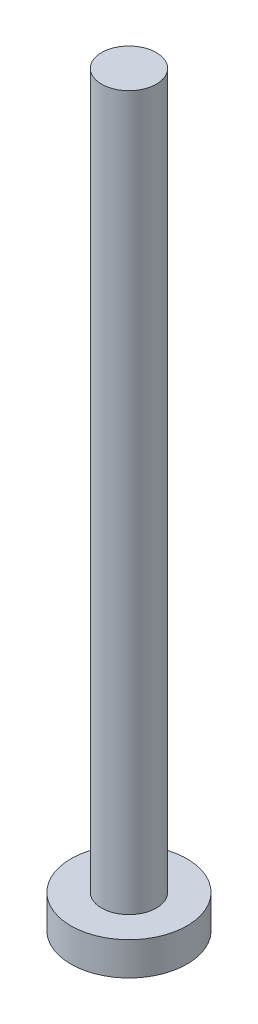
from build123d import *

# Parameters (mm, degrees)
SKETCH1_R           = 7
BOSS_EXTRUDE1_DEPTH = 4
SKETCH2_R           = 3.3
BOSS_EXTRUDE2_DEPTH = 86


with BuildPart() as part:
    # Sketch1 → Boss-Extrude1 (new body)
    with BuildSketch(Plane(origin=(0, 0, 0), x_dir=(1, 0, 0), z_dir=(0, 1, 0))):
        with Locations(Location((0, 0, 0), (0, 0, 270))):
            Circle(SKETCH1_R)
    extrude(amount=BOSS_EXTRUDE1_DEPTH)

    # Sketch2 → Boss-Extrude2 (add)
    with BuildSketch(Plane(origin=(0, 4, 0), x_dir=(1, 0, 0), z_dir=(0, 1, 0))):
        with Locations(Location((0, 0, 0), (0, 0, 270))):
            Circle(SKETCH2_R)
    extrude(amount=BOSS_EXTRUDE2_DEPTH)


solid = part.part
